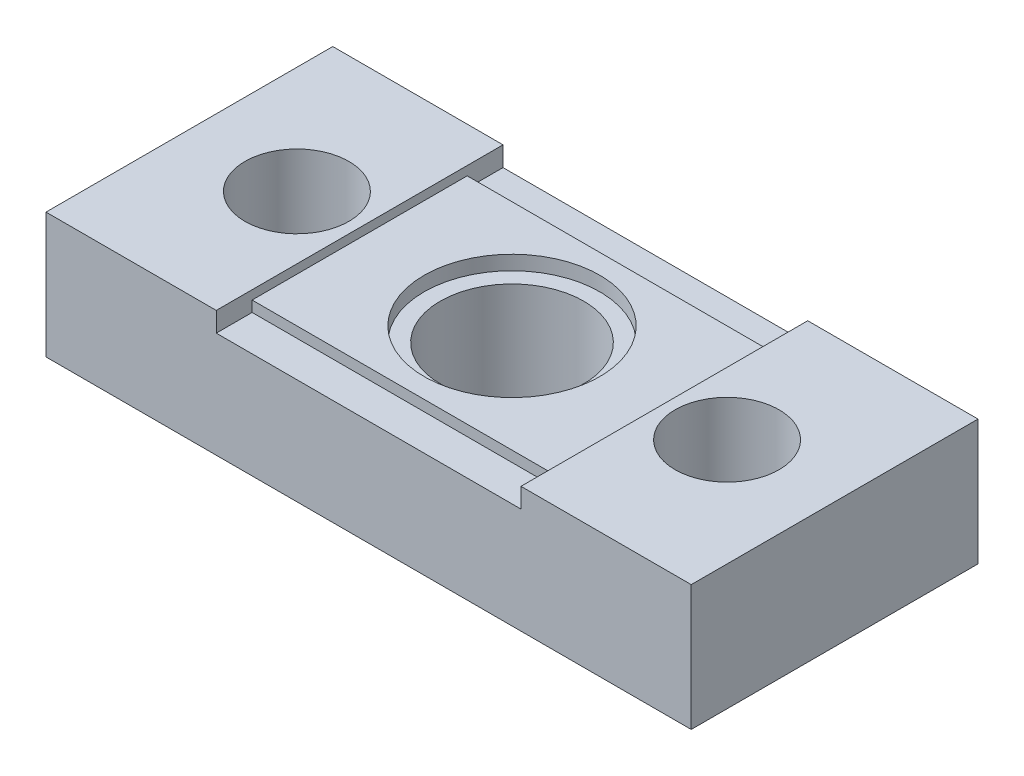
from build123d import *

# Parameters (mm, degrees)
SKETCH_1_W               = 36
SKETCH_1_H               = 16
EXTRUDE_1_DEPTH          = 7
CUT_EXTRUDE_1_DEPTH      = 26.079872408
CUT_EXTRUDE_1_DEPTH_BACK = 26.079872408
SKETCH_5_R               = 4.9
CUT_EXTRUDE_2_DEPTH      = 0.8
SKETCH_6_R               = 4
CUT_EXTRUDE_3_DEPTH      = 21.505852823
SKETCH_7_W               = 17
SKETCH_7_H               = 2
CUT_EXTRUDE_4_DEPTH      = 0.6
SKETCH_8_W               = 17
SKETCH_8_H               = 2
CUT_EXTRUDE_5_DEPTH      = 0.6
SKETCH_9_R               = 2.9
CUT_EXTRUDE_6_DEPTH      = 21.90454496


with BuildPart() as part:
    # 草图1 → 凸台-拉伸1 (new body)
    with BuildSketch(Plane(origin=(0, 0, 0), x_dir=(1, 0, 0), z_dir=(0, 1, 0))):
        Rectangle(SKETCH_1_W, SKETCH_1_H)
    extrude(amount=EXTRUDE_1_DEPTH)

    # 草图4 → 切除-拉伸1 (cut, two sides: drawn at the far end of the back side and taken through both)
    with BuildSketch(Plane(origin=(0, 0, -8), x_dir=(-1, 0, 0), z_dir=(0, 0, -1)).offset(-CUT_EXTRUDE_1_DEPTH_BACK)):
        Polygon((-8.5, 71.817880295), (-8.5, 7), (-8.5, 6.5), (8.5, 6.5), (8.5, 7), (8.5, 71.817880295), (8.5, 201.453640884), (-8.5, 201.453640884), align=None)
    extrude(amount=CUT_EXTRUDE_1_DEPTH + CUT_EXTRUDE_1_DEPTH_BACK, mode=Mode.SUBTRACT)

    # 草图5 → 切除-拉伸2 (cut)
    with BuildSketch(Plane(origin=(0, 6.5, 0), x_dir=(1, 0, 0), z_dir=(0, 1, 0))):
        with Locations(Location((0, 0, 0), (0, 0, 180))):
            Circle(SKETCH_5_R)
    extrude(amount=-CUT_EXTRUDE_2_DEPTH, mode=Mode.SUBTRACT)

    # 草图6 → 切除-拉伸3 (cut, through all)
    with BuildSketch(Plane(origin=(0, 5.7, 0), x_dir=(1, 0, 0), z_dir=(0, 1, 0))):
        with Locations(Location((0, 0, 0), (0, 0, 180))):
            Circle(SKETCH_6_R)
    extrude(amount=-CUT_EXTRUDE_3_DEPTH, mode=Mode.SUBTRACT)

    # 草图7 → 切除-拉伸4 (cut)
    with BuildSketch(Plane(origin=(0, 6.5, 0), x_dir=(1, 0, 0), z_dir=(0, 1, 0))):
        with Locations((0, 7)):
            Rectangle(SKETCH_7_W, SKETCH_7_H)
    extrude(amount=-CUT_EXTRUDE_4_DEPTH, mode=Mode.SUBTRACT)

    # 草图8 → 切除-拉伸5 (cut)
    with BuildSketch(Plane(origin=(0, 6.5, 0), x_dir=(1, 0, 0), z_dir=(0, 1, 0))):
        with Locations((0, -7)):
            Rectangle(SKETCH_8_W, SKETCH_8_H)
    extrude(amount=-CUT_EXTRUDE_5_DEPTH, mode=Mode.SUBTRACT)

    # 草图9 → 切除-拉伸6 (cut, through all)
    with BuildSketch(Plane(origin=(0, 7, 0), x_dir=(1, 0, 0), z_dir=(0, 1, 0))):
        with Locations(Location((-12, 0, 0), (0, 0, 270))):
            Circle(SKETCH_9_R)
        with Locations(Location((12, 0, 0), (0, 0, 270))):
            Circle(SKETCH_9_R)
    extrude(amount=-CUT_EXTRUDE_6_DEPTH, mode=Mode.SUBTRACT)


solid = part.part
